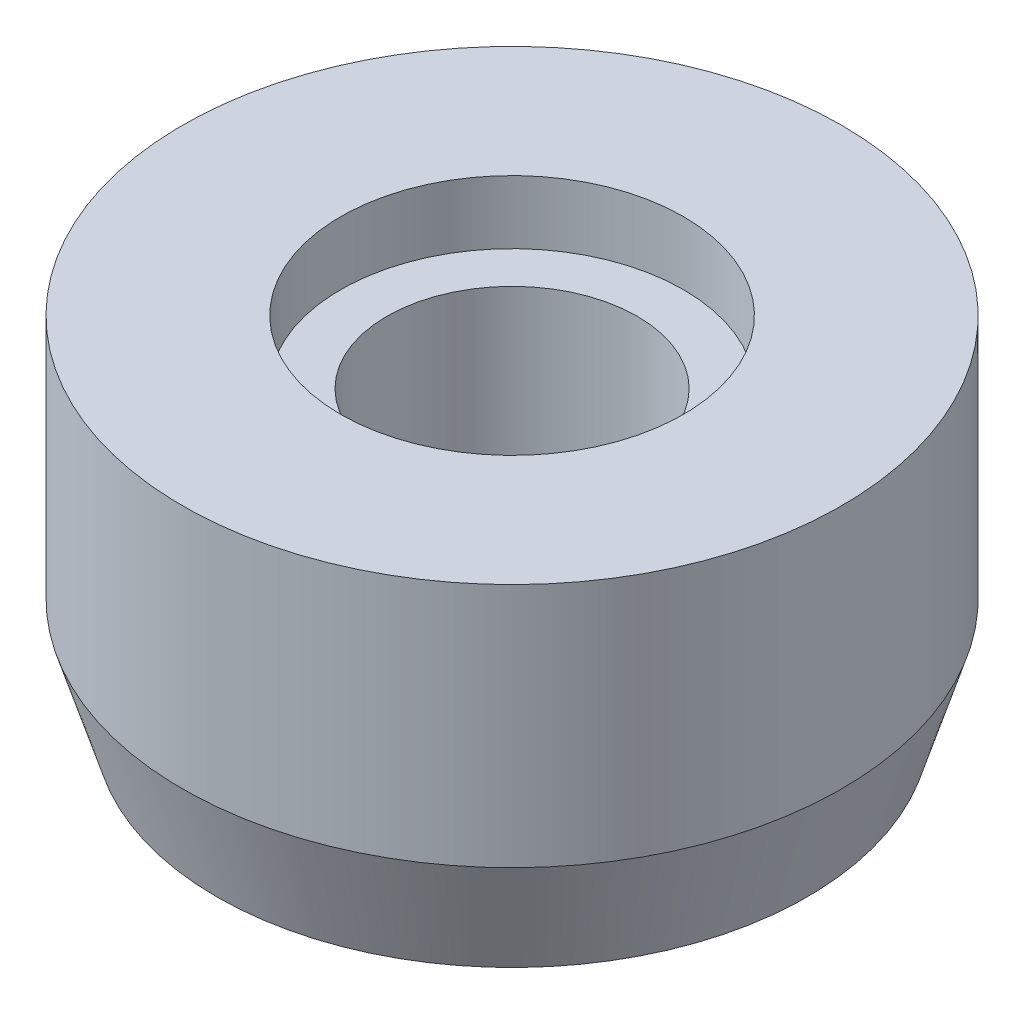
from build123d import *


with BuildPart() as part:
    # Sketch1 → Revolve1 (revolve)
    with BuildSketch(Plane.XY, mode=Mode.PRIVATE) as revolve1_sk:
        Polygon((4.75, 15.497873158), (4.75, 26.585704679), (6.5, 26.585704679), (6.5, 28.985704679), (12.5, 28.985704679), (12.5, 19.685693184), (11.2, 15.487731956), align=None)
    revolve(revolve1_sk.sketch.rotate(Axis((0, 0, 0), (0, 1, 0)), 90), axis=Axis((0, 0, 0), (0, 1, 0)))


solid = part.part
